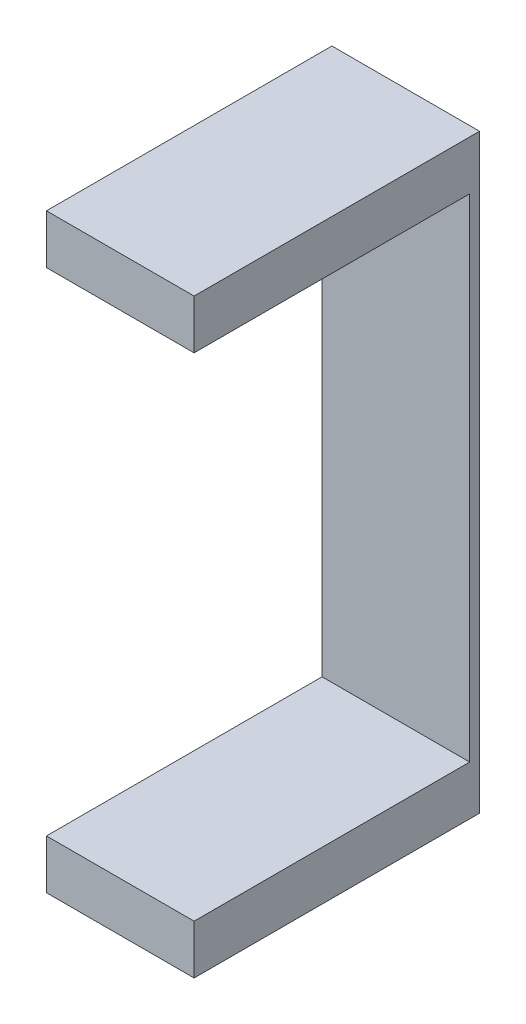
from build123d import *

# Parameters (mm, degrees)
SKETCH2_W           = 120
SKETCH2_H           = 30
BOSS_EXTRUDE1_DEPTH = 2
SKETCH3_W           = 30
SKETCH3_H           = 10
BOSS_EXTRUDE2_DEPTH = 56


with BuildPart() as part:
    # Sketch2 → Boss-Extrude1 (new body)
    with BuildSketch(Plane(origin=(0, 0, 0), x_dir=(0, 1, 0), z_dir=(0, 0, 1))):
        Rectangle(SKETCH2_W, SKETCH2_H)
    extrude(amount=BOSS_EXTRUDE1_DEPTH)

    # Sketch3 → Boss-Extrude2 (add)
    with BuildSketch(Plane.XY.offset(2)):
        with Locations((0, 55)):
            Rectangle(SKETCH3_W, SKETCH3_H)
        with Locations((0, -55)):
            Rectangle(SKETCH3_W, SKETCH3_H)
    extrude(amount=BOSS_EXTRUDE2_DEPTH)


solid = part.part
